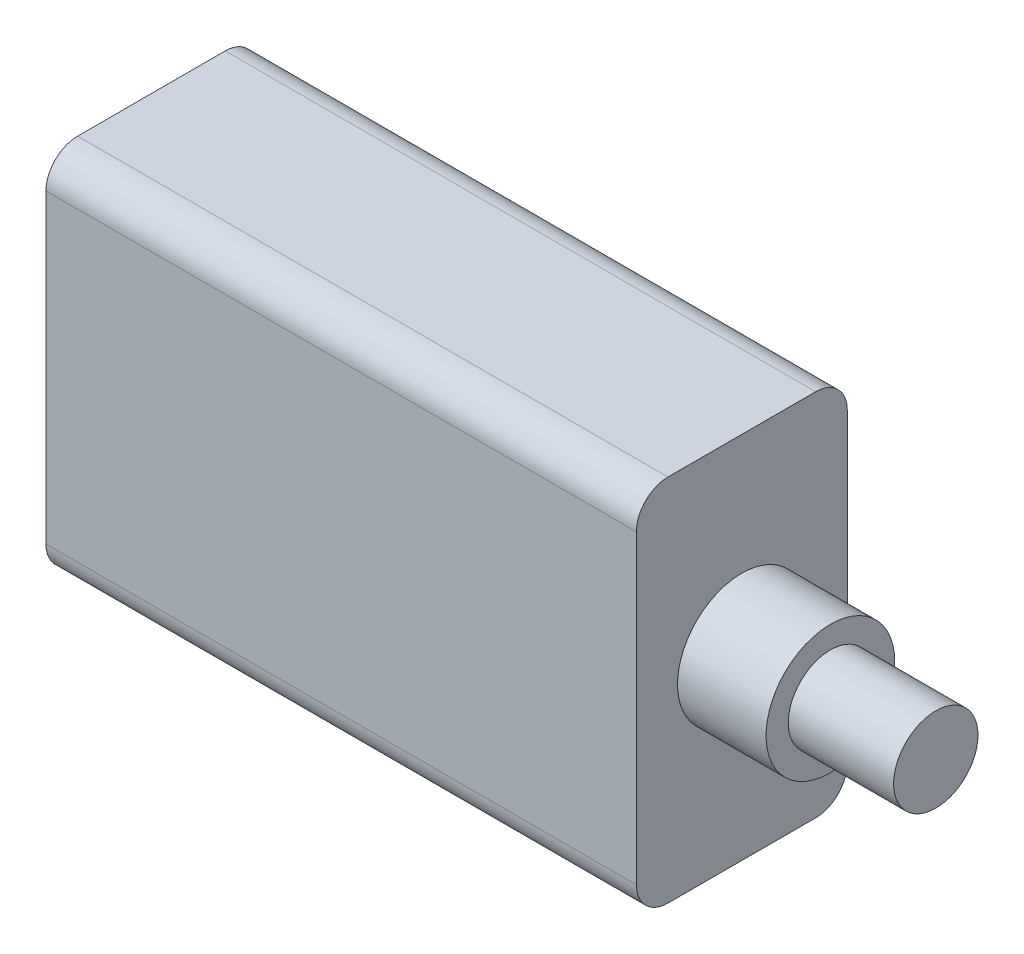
from build123d import *

# Parameters (mm, degrees)
SKETCH1_W           = 28
SKETCH1_H           = 17.5
BOSS_EXTRUDE1_DEPTH = 10
SKETCH3_W           = 4.6
SKETCH3_H           = 12
CUT_EXTRUDE1_DEPTH  = 8.6
SKETCH4_R           = 3.05
BOSS_EXTRUDE2_DEPTH = 4.2
SKETCH5_R           = 2
BOSS_EXTRUDE3_DEPTH = 5
FILLET1_R           = 1.5


with BuildPart() as part:
    # Sketch1 → Boss-Extrude1 (new body)
    with BuildSketch(Plane.XY):
        with Locations((14, 8.75)):
            Rectangle(SKETCH1_W, SKETCH1_H)
    extrude(amount=BOSS_EXTRUDE1_DEPTH)

    # Sketch3 → Cut-Extrude1 (cut)
    with BuildSketch(Plane.ZY):
        with Locations((5, 8.75)):
            Rectangle(SKETCH3_W, SKETCH3_H)
    extrude(amount=-CUT_EXTRUDE1_DEPTH, mode=Mode.SUBTRACT)

    # Sketch4 → Boss-Extrude2 (add)
    with BuildSketch(Plane(origin=(28, 0, 0), x_dir=(0, 0, -1), z_dir=(1, 0, 0))):
        with Locations((-5, 8.75)):
            Circle(SKETCH4_R)
    extrude(amount=BOSS_EXTRUDE2_DEPTH)

    # Sketch5 → Boss-Extrude3 (add)
    with BuildSketch(Plane(origin=(32.2, 0, 0), x_dir=(0, 0, -1), z_dir=(1, 0, 0))):
        with Locations((-5, 8.75)):
            Circle(SKETCH5_R)
    extrude(amount=BOSS_EXTRUDE3_DEPTH)

    # Fillet1
    fillet1_edges = [part.edges().sort_by_distance(p)[0] for p in [
        (14, 17.5, 10),
        (14, 17.5, 0),
        (14, 0, 0),
        (14, 0, 10),
    ]]
    fillet(fillet1_edges, radius=FILLET1_R)


solid = part.part
